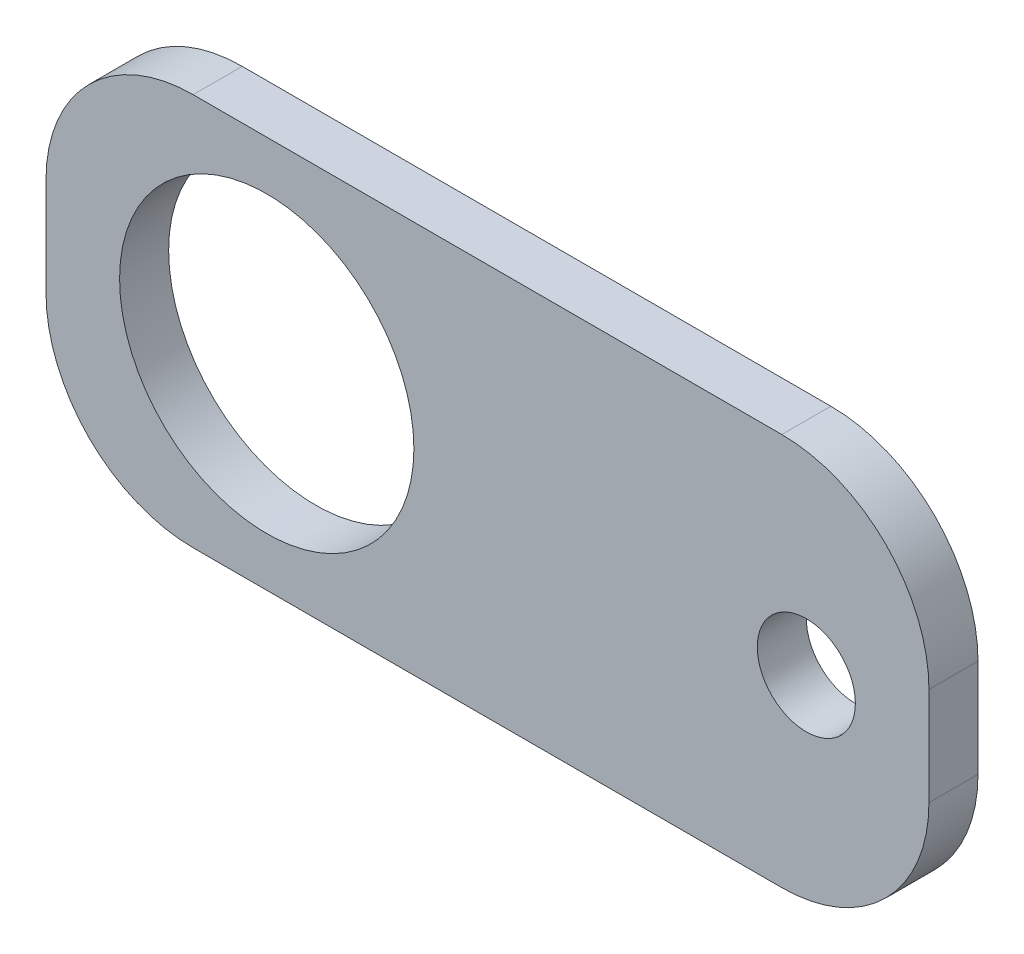
from build123d import *

# Parameters (mm, degrees)
SKETCH1_W           = 8
SKETCH1_H           = 18
SKETCH1_R           = 1
SKETCH1_R_2         = 3
BOSS_EXTRUDE1_DEPTH = 1
FILLET1_R           = 3


with BuildPart() as part:
    # Sketch1 → Boss-Extrude1 (new body)
    with BuildSketch(Plane(origin=(0, 0, 0), x_dir=(0, 1, 0), z_dir=(0, 0, 1))):
        with Locations((4, -9)):
            Rectangle(SKETCH1_W, SKETCH1_H)
        with Locations(Location((4, -15.5, 0), (0, 0, 270))):
            Circle(SKETCH1_R, mode=Mode.SUBTRACT)
        with Locations(Location((4, -4.5, 0), (0, 0, 270))):
            Circle(SKETCH1_R_2, mode=Mode.SUBTRACT)
    extrude(amount=BOSS_EXTRUDE1_DEPTH)

    # Fillet1
    fillet1_edges = [part.edges().sort_by_distance(p)[0] for p in [
        (0, 0, 0.5),
        (0, 8, 0.5),
        (18, 8, 0.5),
        (18, 0, 0.5),
    ]]
    fillet(fillet1_edges, radius=FILLET1_R)


solid = part.part
